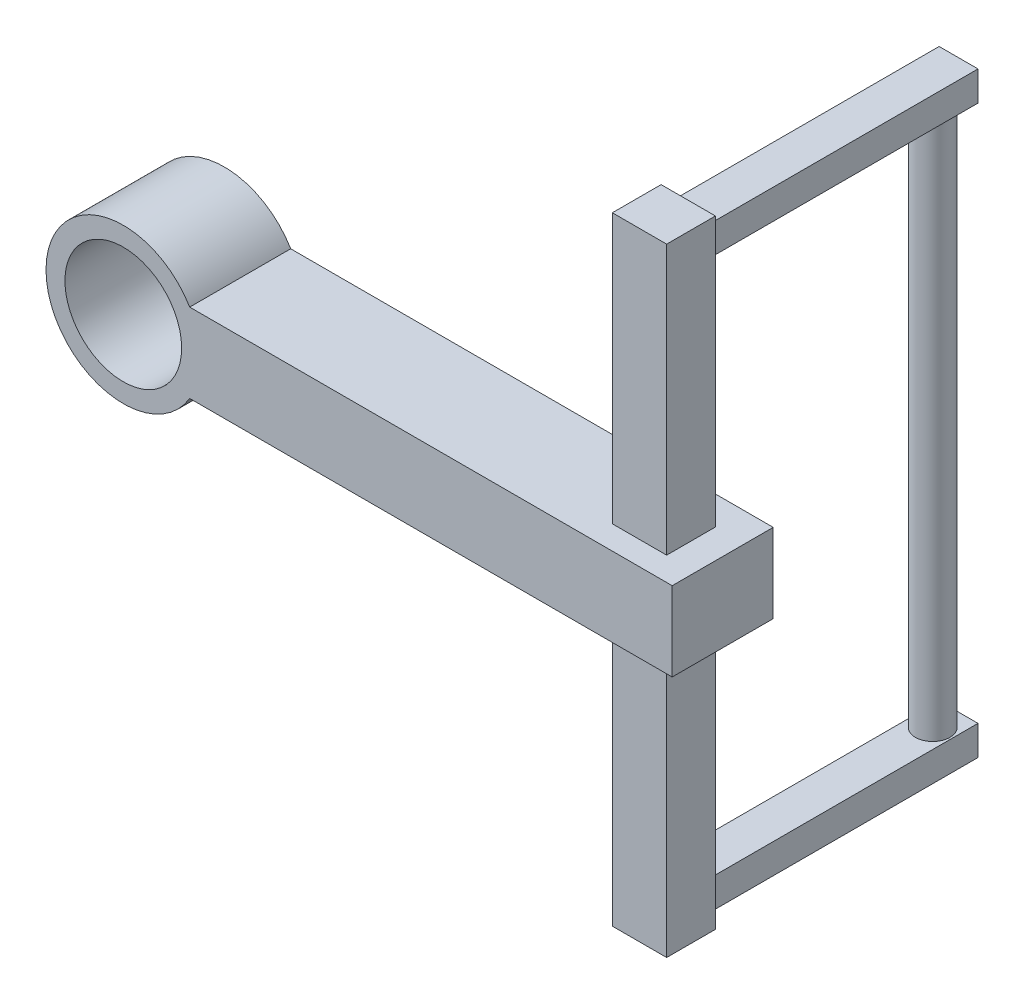
from build123d import *

# Parameters (mm, degrees)
SKETCH1_R           = 17.326400039
BOSS_EXTRUDE1_DEPTH = 30
SKETCH3_W           = 16.12994251
SKETCH3_H           = 14.480289299
BOSS_EXTRUDE2_DEPTH = 80
SKETCH4_W           = 11.547572479
SKETCH4_H           = 8.79815046
BOSS_EXTRUDE3_DEPTH = 80
SKETCH5_R           = 5.135526513
BOSS_EXTRUDE4_DEPTH = 162


with BuildPart() as part:
    # Sketch1 → Boss-Extrude1 (new body)
    with BuildSketch(Plane.XY):
        with BuildLine():
            Line((19.721500067, 11.745451968), (163.015891701, 11.745451968))
            Line((163.015891701, 11.745451968), (163.015891701, -11.745451968))
            Line((163.015891701, -11.745451968), (19.721500067, -11.745451968))
            ThreePointArc((19.721500067, -11.745451968), (-22.954154456, 0), (19.721500067, 11.745451968))
        make_face()
        Circle(SKETCH1_R, mode=Mode.SUBTRACT)
    extrude(amount=BOSS_EXTRUDE1_DEPTH)

    # Sketch3 → Boss-Extrude2 (add)
    with BuildSketch(Plane(origin=(0, 11.745451968, 0), x_dir=(1, 0, 0), z_dir=(0, 1, 0))):
        with Locations((146.281505943, -15.733179206)):
            Rectangle(SKETCH3_W, SKETCH3_H)
    boss_extrude2 = extrude(amount=BOSS_EXTRUDE2_DEPTH)

    # Sketch4 → Boss-Extrude3 (add)
    with BuildSketch(Plane(origin=(0, 0, 8.493034556), x_dir=(-1, 0, 0), z_dir=(0, 0, -1))):
        with Locations((-146.556448146, 84.160187296)):
            Rectangle(SKETCH4_W, SKETCH4_H)
    boss_extrude3 = extrude(amount=BOSS_EXTRUDE3_DEPTH)

    # Mirror1: Boss-Extrude2, Boss-Extrude3 across plane
    add(boss_extrude2.mirror(Plane.ZX))
    add(boss_extrude3.mirror(Plane.ZX))

    # Sketch5 → Boss-Extrude4 (add)
    with BuildSketch(Plane(origin=(0, -79.761112066, 0), x_dir=(1, 0, 0), z_dir=(0, 1, 0))):
        with Locations(Location((146.648095546, 63.736113616, 0), (0, 0, 270))):
            Circle(SKETCH5_R)
    extrude(amount=BOSS_EXTRUDE4_DEPTH)


solid = part.part
